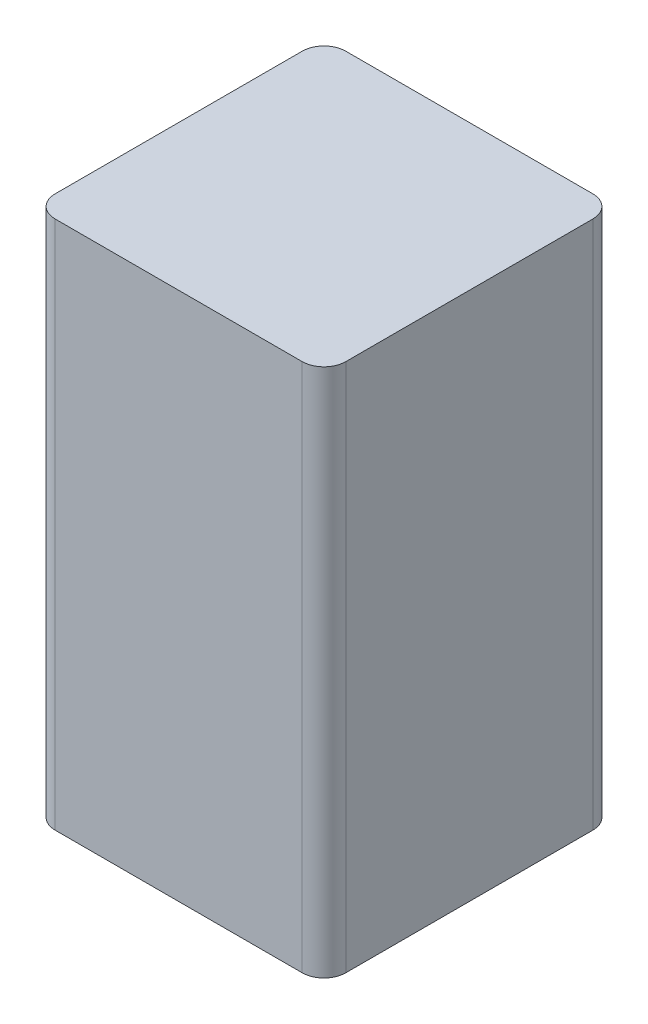
from build123d import *

# Parameters (mm, degrees)
SKETCH_1_W               = 40
SKETCH_1_H               = 72.85
BLOCKEXTRUDE_DEPTH       = 40
FILLET_2_R               = 3
SKETCH_2_R               = 4.15
MOTOR_SHAFT_SOCKET_DEPTH = 26


with BuildPart() as part:
    # 草图1 → BlockExtrude (new body)
    with BuildSketch(Plane.XY):
        with Locations((20, 36.425)):
            Rectangle(SKETCH_1_W, SKETCH_1_H)
    extrude(amount=BLOCKEXTRUDE_DEPTH)

    # Fillet 2
    fillet_2_edges = [part.edges().sort_by_distance(p)[0] for p in [
        (40, 36.425, 40),
        (0, 36.425, 40),
        (40, 36.425, 0),
        (0, 36.425, 0),
    ]]
    fillet(fillet_2_edges, radius=FILLET_2_R)

    # 草图2 → Motor_shaft_socket (cut)
    with BuildSketch(Plane.XZ):
        with Locations(Location((20, 20, 0), (0, 0, 270))):
            Circle(SKETCH_2_R)
    extrude(amount=-MOTOR_SHAFT_SOCKET_DEPTH, mode=Mode.SUBTRACT)


solid = part.part
